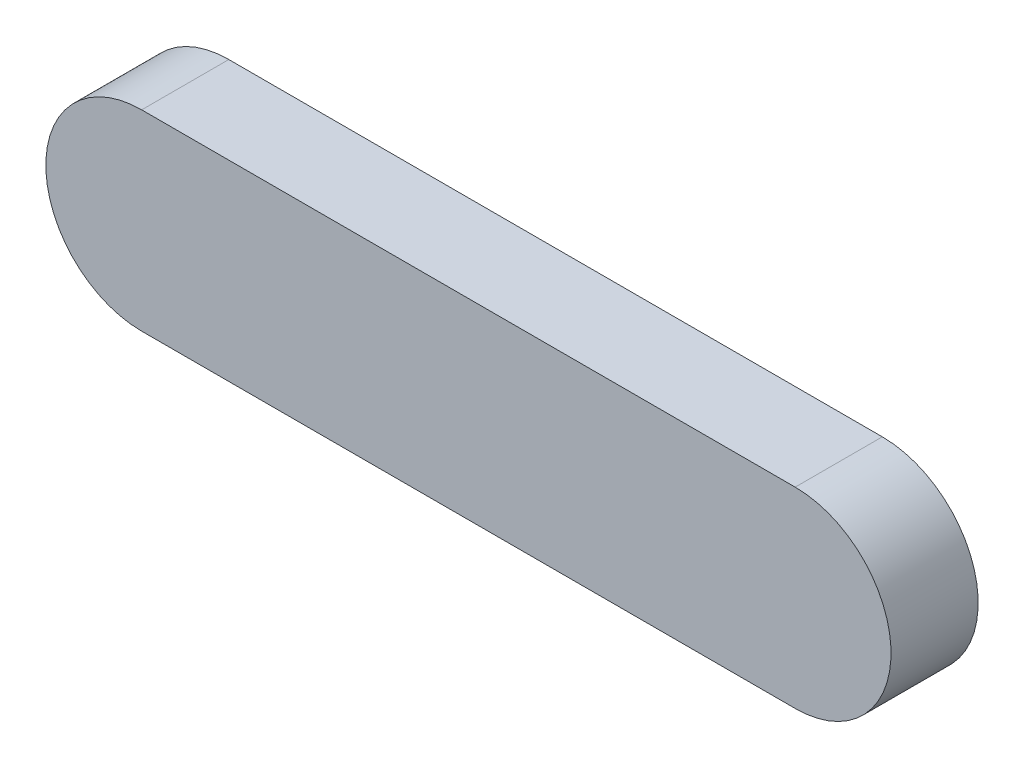
from build123d import *

# Parameters (mm, degrees)
COUPLERLINK_DEPTH = 10


with BuildPart() as part:
    # 草图3 → CouplerLink (new body)
    with BuildSketch(Plane.XY):
        with BuildLine():
            Line((20, 61), (95, 61))
            ThreePointArc((95, 61), (106, 50), (95, 39))
            Line((95, 39), (20, 39))
            ThreePointArc((20, 39), (9, 50), (20, 61))
        make_face()
    extrude(amount=COUPLERLINK_DEPTH)


solid = part.part
